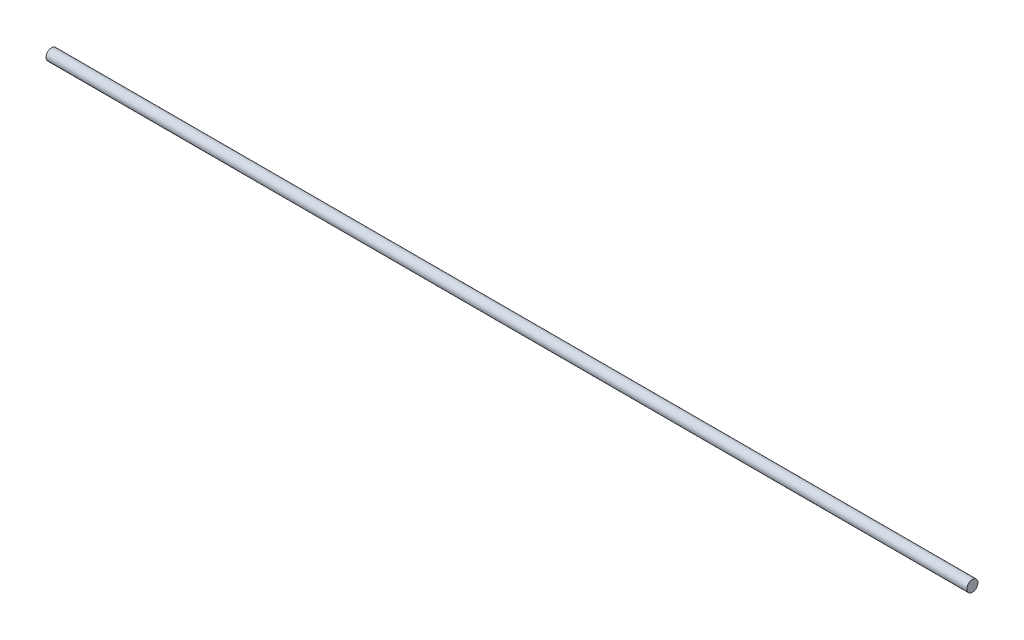
from build123d import *

# Parameters (mm, degrees)
ESBO_O1_R                = 2.5
RESSALTO_EXTRUS_O1_DEPTH = 206


with BuildPart() as part:
    # Esboço1 → Ressalto-extrusão1 (new, symmetric)
    with BuildSketch(Plane(origin=(0, 0, 0), x_dir=(0, 0, -1), z_dir=(1, 0, 0))):
        Circle(ESBO_O1_R)
    extrude(amount=RESSALTO_EXTRUS_O1_DEPTH, both=True)


solid = part.part
